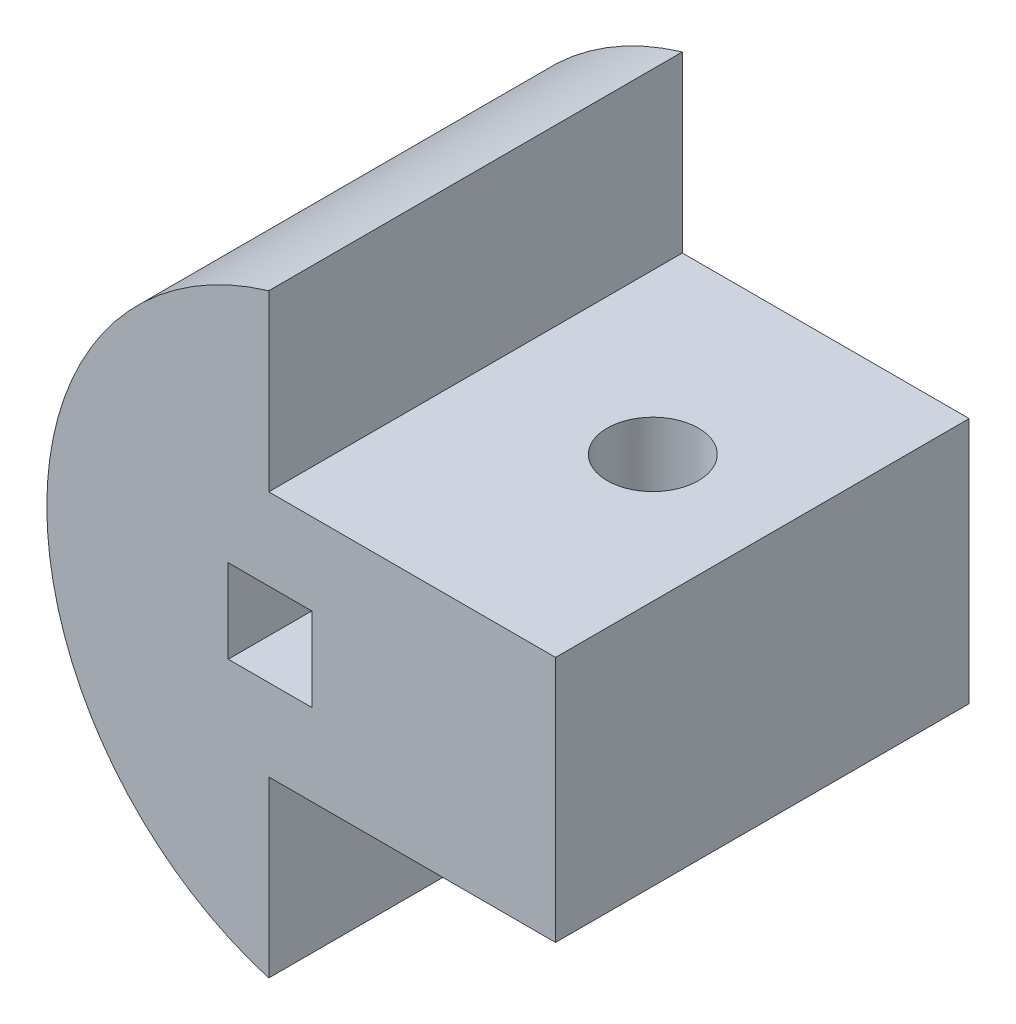
from build123d import *

# Parameters (mm, degrees)
SKETCH2_W           = 3.35
SKETCH2_H           = 3.35
BOSS_EXTRUDE1_DEPTH = 16.586038969
SKETCH4_R           = 1.8288
CUT_EXTRUDE1_DEPTH  = 27.291440529


with BuildPart() as part:
    # Sketch2 → Boss-Extrude1 (new body)
    with BuildSketch(Plane.XY):
        with BuildLine():
            Line((-0.05, 19.933147112), (-0.05, 12.95))
            Line((-0.05, 12.95), (11.45, 12.95))
            Line((11.45, 12.95), (11.45, 8))
            Line((11.45, 8), (11.45, 3.05))
            Line((11.45, 3.05), (-0.05, 3.05))
            Line((-0.05, 3.05), (-0.05, -3.933147112))
            ThreePointArc((-0.05, -3.933147112), (-8.95, 8), (-0.05, 19.933147112))
        make_face()
        with Locations((0, 8)):
            Rectangle(SKETCH2_W, SKETCH2_H, mode=Mode.SUBTRACT)
    extrude(amount=-BOSS_EXTRUDE1_DEPTH)

    # Sketch4 → Cut-Extrude1 (cut, through all)
    with BuildSketch(Plane.XZ.offset(-3.05)):
        with Locations((6.35, -9)):
            Circle(SKETCH4_R)
    extrude(amount=-CUT_EXTRUDE1_DEPTH, mode=Mode.SUBTRACT)


solid = part.part
